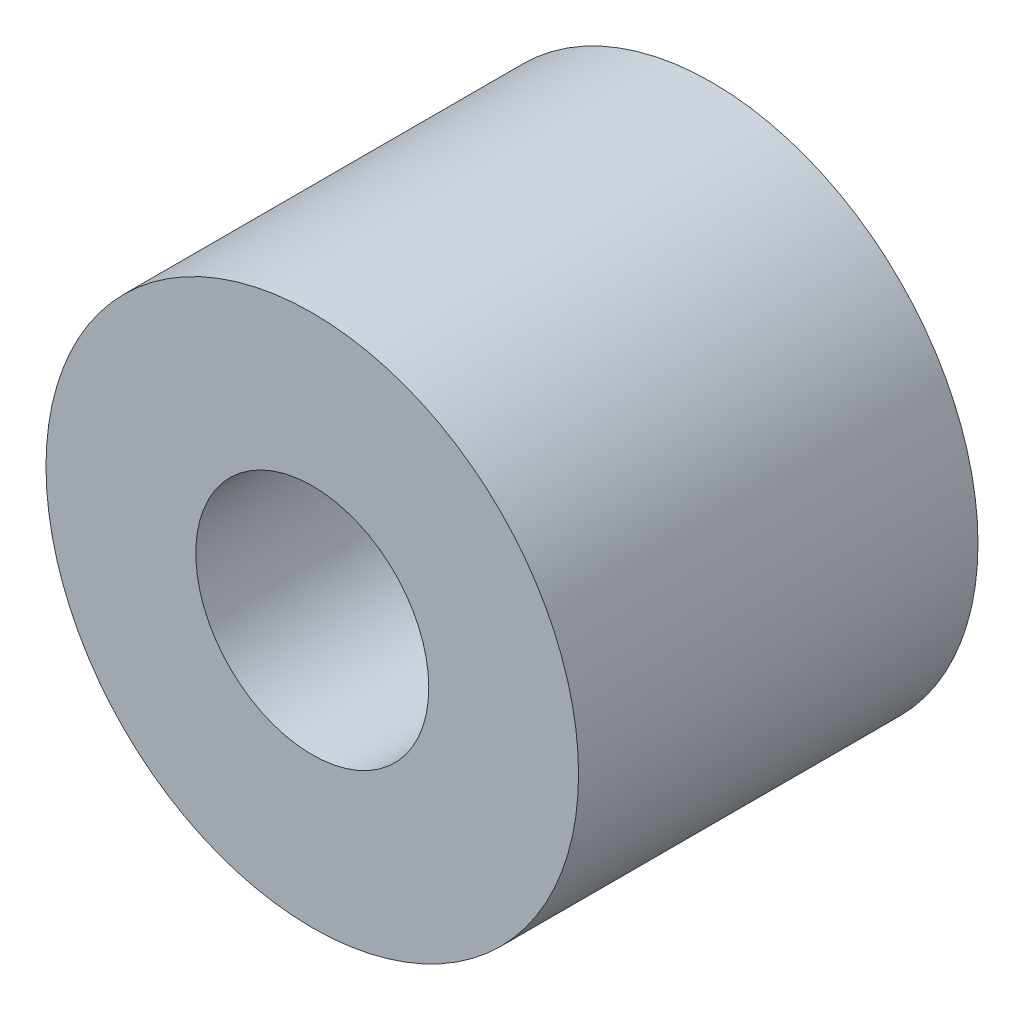
from build123d import *

# Parameters (mm, degrees)
CROQUIS1_R              = 4
CROQUIS1_R_2            = 1.75
SALIENTE_EXTRUIR1_DEPTH = 6


with BuildPart() as part:
    # Croquis1 → Saliente-Extruir1 (new body)
    with BuildSketch(Plane.XY):
        Circle(CROQUIS1_R)
        Circle(CROQUIS1_R_2, mode=Mode.SUBTRACT)
    extrude(amount=SALIENTE_EXTRUIR1_DEPTH)


solid = part.part
